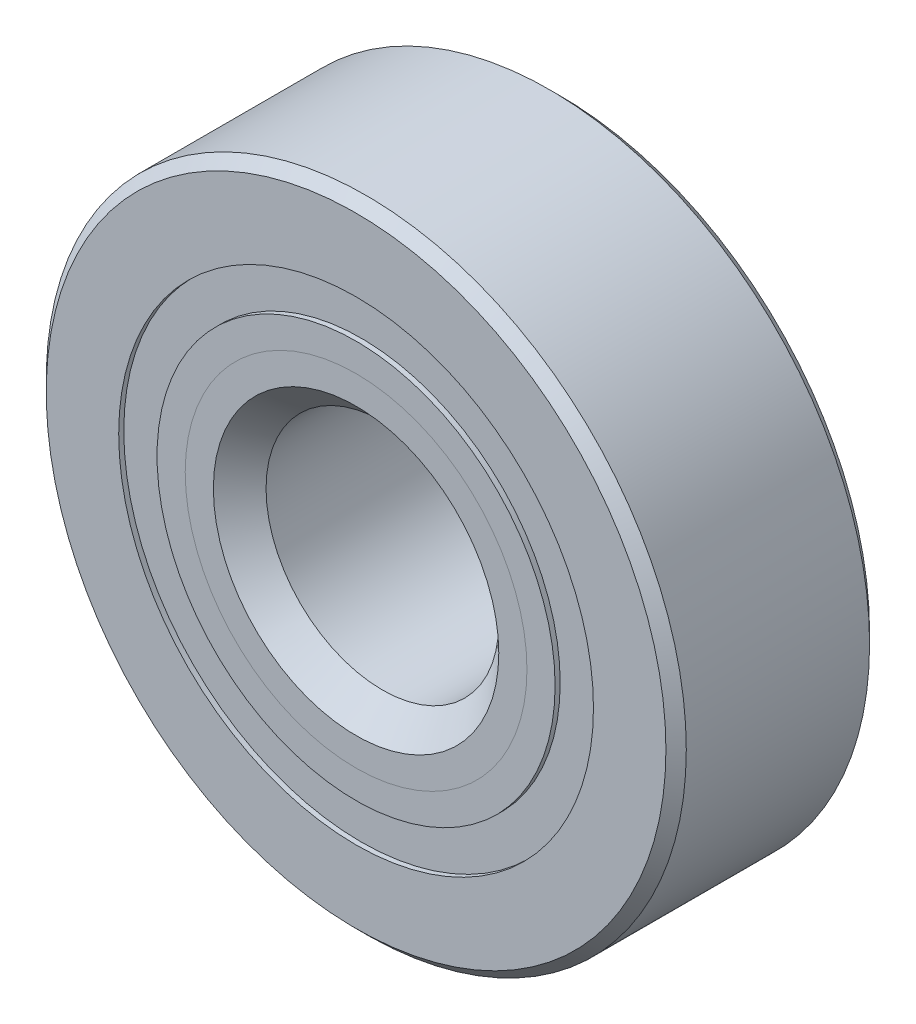
from build123d import *

# Parameters (mm, degrees)
CIRPATTERN1_COUNT = 12
SKETCH5_W         = 2.596321981
SKETCH5_H         = 2.093406594


with BuildPart() as part:
    # Sketch1 → Revolve1 (revolve)
    with BuildSketch(Plane(origin=(0, 0, 0), x_dir=(0, 0, -1), z_dir=(1, 0, 0))):
        with BuildLine():
            Line((5.000625, 17.4625), (-5.000625, 17.4625))
            Line((-5.000625, 17.4625), (-5.55625, 16.906875))
            Line((-5.55625, 16.906875), (-5.55625, 12.952953297))
            Line((-5.55625, 12.952953297), (-2.469444444, 12.952953297))
            ThreePointArc((-2.469444444, 12.952953297), (0, 14.588365519), (2.469444444, 12.952953297))
            Line((2.469444444, 12.952953297), (5.55625, 12.952953297))
            Line((5.55625, 12.952953297), (5.55625, 16.906875))
            Line((5.55625, 16.906875), (5.000625, 17.4625))
        make_face()
    revolve(axis=Axis((0, 0, 5.55625), (0, 0, -1)))


with BuildPart() as body_2:
    # Sketch2 → Revolve2 (revolve)
    with BuildSketch(Plane(origin=(0, 0, 0), x_dir=(0, 0, -1), z_dir=(1, 0, 0))):
        with BuildLine():
            Line((-5.55625, 10.859546703), (-2.469444444, 10.859546703))
            ThreePointArc((-2.469444444, 10.859546703), (-1.480939651, 9.670056492), (0, 9.224134481))
            Line((0, 9.224134481), (0, 7.787067241))
            Line((0, 7.787067241), (-4.020010269, 7.787067241))
            Line((-4.020010269, 7.787067241), (-5.55625, 9.323306972))
            Line((-5.55625, 9.323306972), (-5.55625, 10.859546703))
        make_face()
    revolve(axis=Axis((0, 0, 5.55625), (0, 0, -1)))


with BuildPart() as body_3:
    # Sketch3 → Revolve3 (revolve)
    with BuildSketch(Plane(origin=(0, 0, 0), x_dir=(0, 0, -1), z_dir=(1, 0, 0))):
        with BuildLine():
            Line((-5.55625, 9.323306972), (-4.020010269, 7.787067241))
            Line((-4.020010269, 7.787067241), (0, 7.787067241))
            Line((0, 7.787067241), (0, 9.224134481))
            ThreePointArc((0, 9.224134481), (1.480939651, 9.670056492), (2.469444444, 10.859546703))
            Line((2.469444444, 10.859546703), (5.55625, 10.859546703))
            Line((5.55625, 10.859546703), (5.55625, 6.905625))
            Line((5.55625, 6.905625), (5.000625, 6.35))
            Line((5.000625, 6.35), (-4.119182759, 6.35))
            Line((-4.119182759, 6.35), (-5.55625, 7.787067241))
            Line((-5.55625, 7.787067241), (-5.55625, 9.323306972))
        make_face()
    revolve(axis=Axis((0, 0, 5.55625), (0, 0, -1)))


with BuildPart() as body_4:
    # Sketch4 → Revolve4 (revolve)
    with BuildSketch(Plane(origin=(0, 0, 0), x_dir=(0, 0, -1), z_dir=(1, 0, 0))):
        with BuildLine():
            Line((-2.682115519, 11.90625), (2.682115519, 11.90625))
            ThreePointArc((2.682115519, 11.90625), (0, 14.588365519), (-2.682115519, 11.90625))
        make_face()
    revolve(axis=Axis((0, 11.90625, 2.682115519), (0, 0, -1)))


with BuildPart() as cirpattern1_1:
    # CirPattern1: pattern copy
    add(body_4.part.rotate(Axis((0, 0, -5.55625), (0, 0, 1)), 1 * 360 / CIRPATTERN1_COUNT))


with BuildPart() as cirpattern1_2:
    # CirPattern1: pattern copy
    add(body_4.part.rotate(Axis((0, 0, -5.55625), (0, 0, 1)), 2 * 360 / CIRPATTERN1_COUNT))


with BuildPart() as cirpattern1_3:
    # CirPattern1: pattern copy
    add(body_4.part.rotate(Axis((0, 0, -5.55625), (0, 0, 1)), 3 * 360 / CIRPATTERN1_COUNT))


with BuildPart() as cirpattern1_4:
    # CirPattern1: pattern copy
    add(body_4.part.rotate(Axis((0, 0, -5.55625), (0, 0, 1)), 4 * 360 / CIRPATTERN1_COUNT))


with BuildPart() as cirpattern1_5:
    # CirPattern1: pattern copy
    add(body_4.part.rotate(Axis((0, 0, -5.55625), (0, 0, 1)), 5 * 360 / CIRPATTERN1_COUNT))


with BuildPart() as cirpattern1_6:
    # CirPattern1: pattern copy
    add(body_4.part.rotate(Axis((0, 0, -5.55625), (0, 0, 1)), 6 * 360 / CIRPATTERN1_COUNT))


with BuildPart() as cirpattern1_7:
    # CirPattern1: pattern copy
    add(body_4.part.rotate(Axis((0, 0, -5.55625), (0, 0, 1)), 7 * 360 / CIRPATTERN1_COUNT))


with BuildPart() as cirpattern1_8:
    # CirPattern1: pattern copy
    add(body_4.part.rotate(Axis((0, 0, -5.55625), (0, 0, 1)), 8 * 360 / CIRPATTERN1_COUNT))


with BuildPart() as cirpattern1_9:
    # CirPattern1: pattern copy
    add(body_4.part.rotate(Axis((0, 0, -5.55625), (0, 0, 1)), 9 * 360 / CIRPATTERN1_COUNT))


with BuildPart() as cirpattern1_10:
    # CirPattern1: pattern copy
    add(body_4.part.rotate(Axis((0, 0, -5.55625), (0, 0, 1)), 10 * 360 / CIRPATTERN1_COUNT))


with BuildPart() as cirpattern1_11:
    # CirPattern1: pattern copy
    add(body_4.part.rotate(Axis((0, 0, -5.55625), (0, 0, 1)), 11 * 360 / CIRPATTERN1_COUNT))


with BuildPart() as body_16:
    # Sketch5 → Revolve5 (revolve)
    with BuildSketch(Plane(origin=(0, 0, 0), x_dir=(0, 0, -1), z_dir=(1, 0, 0))):
        with Locations((-3.98027651, 11.90625)):
            Rectangle(SKETCH5_W, SKETCH5_H)
        with Locations((3.98027651, 11.90625)):
            Rectangle(SKETCH5_W, SKETCH5_H)
    revolve(axis=Axis((0, 0, 5.55625), (0, 0, -1)))


solid = Compound([part.part, body_2.part, body_3.part, body_4.part, cirpattern1_1.part, cirpattern1_2.part, cirpattern1_3.part, cirpattern1_4.part, cirpattern1_5.part, cirpattern1_6.part, cirpattern1_7.part, cirpattern1_8.part, cirpattern1_9.part, cirpattern1_10.part, cirpattern1_11.part, body_16.part])
